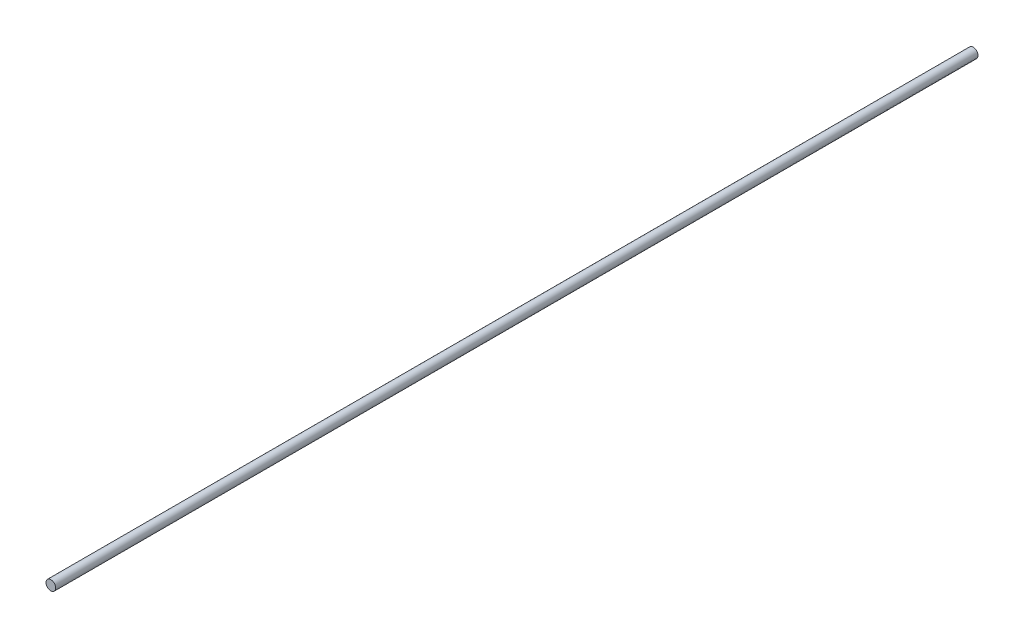
from build123d import *

# Parameters (mm, degrees)
SKETCH1_R           = 1
BOSS_EXTRUDE1_DEPTH = 190


with BuildPart() as part:
    # Sketch1 → Boss-Extrude1 (new body)
    with BuildSketch(Plane.XY):
        Circle(SKETCH1_R)
    extrude(amount=BOSS_EXTRUDE1_DEPTH)


solid = part.part
